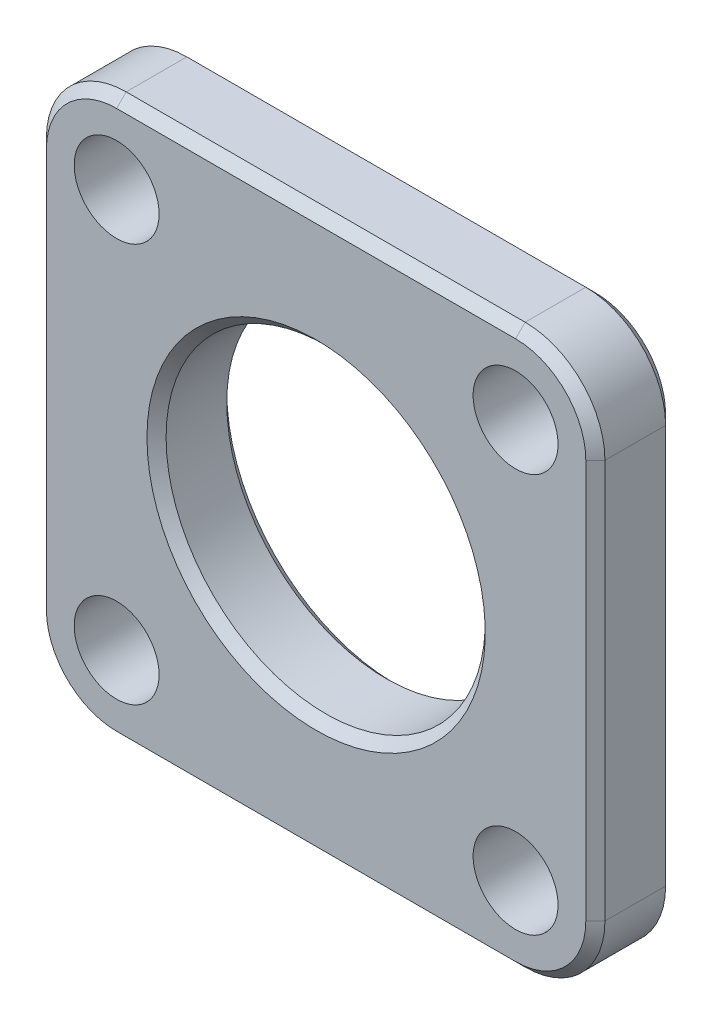
from build123d import *

# Parameters (mm, degrees)
SKETCH1_R               = 12.7
BOSS_EXTRUDE1_DEPTH     = 6.35
F_1_4_CLEARANCE_HOLE1_D = 6.7564
CHAMFER1_SIZE           = 0.762


with BuildPart() as part:
    # Sketch1 → Boss-Extrude1 (new body)
    with BuildSketch(Plane.XY):
        with BuildLine():
            Line((-15.875, -22.225), (15.875, -22.225))
            ThreePointArc((15.875, -22.225), (20.365128061, -20.365128061), (22.225, -15.875))
            Line((22.225, -15.875), (22.225, 15.875))
            ThreePointArc((22.225, 15.875), (20.365128061, 20.365128061), (15.875, 22.225))
            Line((15.875, 22.225), (-15.875, 22.225))
            ThreePointArc((-15.875, 22.225), (-20.365128061, 20.365128061), (-22.225, 15.875))
            Line((-22.225, 15.875), (-22.225, -15.875))
            ThreePointArc((-22.225, -15.875), (-20.365128061, -20.365128061), (-15.875, -22.225))
        make_face()
        Circle(SKETCH1_R, mode=Mode.SUBTRACT)
    extrude(amount=BOSS_EXTRUDE1_DEPTH)

    # 1/4 Clearance Hole1 (through all)
    with Locations(Plane.XY.offset(6.35)):
        with Locations((-15.875, 15.875), (15.875, -15.875), (15.875, 15.875), (-15.875, -15.875)):
            Hole(F_1_4_CLEARANCE_HOLE1_D / 2)

    # Chamfer1
    chamfer1_edges = [part.edges().sort_by_distance(p)[0] for p in [
        (20.365128061, -20.365128061, 6.35),
        (0, -22.225, 0),
        (-20.365128061, -20.365128061, 0),
        (22.225, 0, 6.35),
        (20.365128061, 20.365128061, 6.35),
        (0, 22.225, 6.35),
        (-12.7, 0, 0),
        (-12.7, 0, 6.35),
        (-20.365128061, 20.365128061, 6.35),
        (-22.225, 0, 6.35),
        (-20.365128061, -20.365128061, 6.35),
        (0, -22.225, 6.35),
        (-22.225, 0, 0),
        (-20.365128061, 20.365128061, 0),
        (0, 22.225, 0),
        (20.365128061, 20.365128061, 0),
        (22.225, 0, 0),
        (20.365128061, -20.365128061, 0),
    ]]
    chamfer(chamfer1_edges, length=CHAMFER1_SIZE)


solid = part.part
